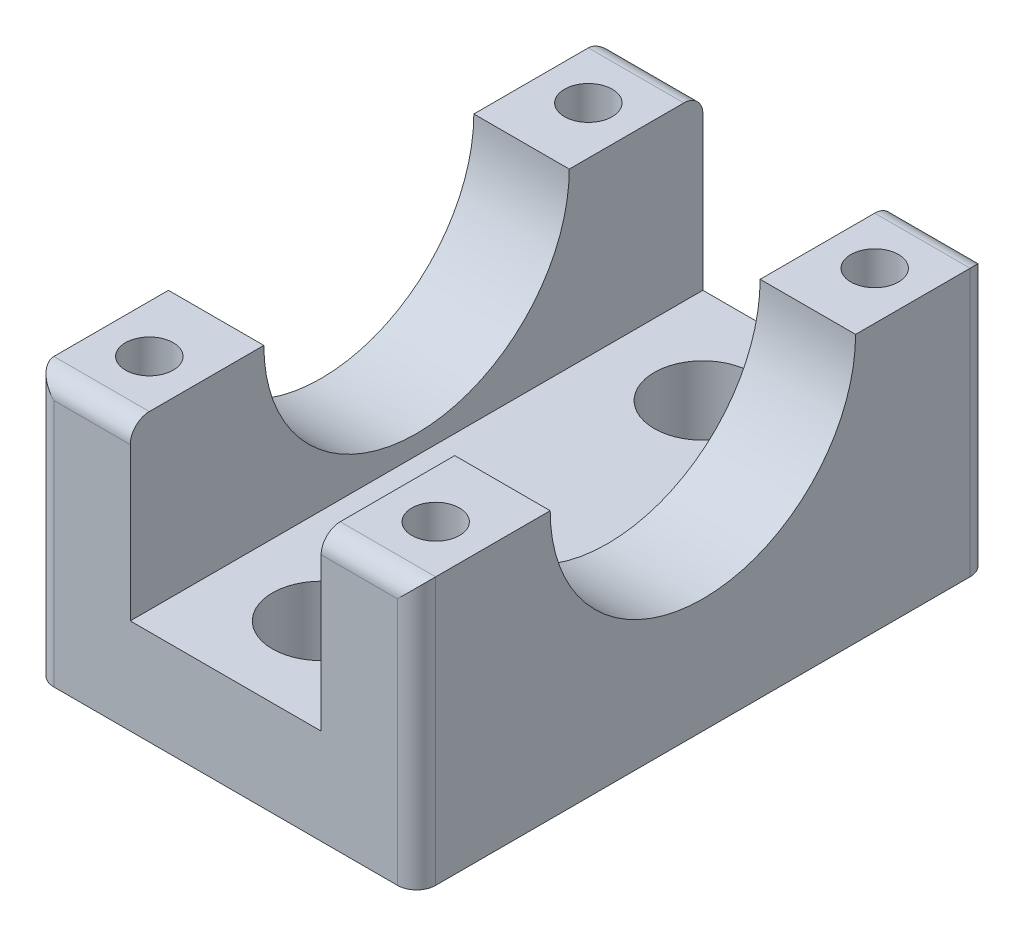
from build123d import *

# Parameters (mm, degrees)
SKETCH1_W           = 20
SKETCH1_H           = 30
BOSS_EXTRUDE1_DEPTH = 5
SKETCH2_R           = 2.55
CUT_EXTRUDE1_DEPTH  = 19.708286934
SKETCH3_W           = 5
SKETCH3_H           = 30
BOSS_EXTRUDE2_DEPTH = 9
SKETCH4_R           = 8
CUT_EXTRUDE2_DEPTH  = 29.653097564
SKETCH5_R           = 1.25
CUT_EXTRUDE3_DEPTH  = 10
FILLET1_R           = 1


with BuildPart() as part:
    # Sketch1 → Boss-Extrude1 (new body)
    with BuildSketch(Plane(origin=(0, 0, 0), x_dir=(1, 0, 0), z_dir=(0, 1, 0))):
        Rectangle(SKETCH1_W, SKETCH1_H)
    extrude(amount=BOSS_EXTRUDE1_DEPTH)

    # Sketch2 → Cut-Extrude1 (cut, through all)
    with BuildSketch(Plane(origin=(0, 5, 0), x_dir=(1, 0, 0), z_dir=(0, 1, 0))):
        with Locations(Location((0, 10, 0), (0, 0, 270))):
            Circle(SKETCH2_R)
        with Locations(Location((0, -10, 0), (0, 0, 270))):
            Circle(SKETCH2_R)
    extrude(amount=-CUT_EXTRUDE1_DEPTH, mode=Mode.SUBTRACT)

    # Sketch3 → Boss-Extrude2 (add)
    with BuildSketch(Plane(origin=(0, 5, 0), x_dir=(1, 0, 0), z_dir=(0, 1, 0))):
        with Locations((-7.5, 0)):
            Rectangle(SKETCH3_W, SKETCH3_H)
    boss_extrude2 = extrude(amount=BOSS_EXTRUDE2_DEPTH)

    # Sketch4 → Cut-Extrude2 (cut, through all)
    with BuildSketch(Plane.ZY.offset(10)):
        with Locations((0, 14)):
            Circle(SKETCH4_R)
    cut_extrude2 = extrude(amount=-CUT_EXTRUDE2_DEPTH, mode=Mode.SUBTRACT)

    # Sketch5 → Cut-Extrude3 (cut)
    with BuildSketch(Plane(origin=(0, 14, 0), x_dir=(1, 0, 0), z_dir=(0, 1, 0))):
        with Locations(Location((-7.5, 11.5, 0), (0, 0, 270))):
            Circle(SKETCH5_R)
        with Locations(Location((-7.5, -11.5, 0), (0, 0, 270))):
            Circle(SKETCH5_R)
    cut_extrude3 = extrude(amount=-CUT_EXTRUDE3_DEPTH, mode=Mode.SUBTRACT)

    # Mirror1: Boss-Extrude2, Cut-Extrude2, Cut-Extrude3 across plane
    add(boss_extrude2.mirror(Plane(origin=(0, 0, 0), x_dir=(0, 0, 1), z_dir=(1, 0, 0))))
    add(cut_extrude2.mirror(Plane(origin=(0, 0, 0), x_dir=(0, 0, 1), z_dir=(1, 0, 0))), mode=Mode.SUBTRACT)
    add(cut_extrude3.mirror(Plane(origin=(0, 0, 0), x_dir=(0, 0, 1), z_dir=(1, 0, 0))), mode=Mode.SUBTRACT)

    # Fillet1
    fillet1_edges = [part.edges().sort_by_distance(p)[0] for p in [
        (-10, 7, -15),
        (10, 7, -15),
        (10, 7, 15),
        (-10, 7, 15),
        (-7.5, 14, -15),
        (7.5, 14, -15),
        (7.5, 14, 15),
        (-7.5, 14, 15),
    ]]
    fillet(fillet1_edges, radius=FILLET1_R)


solid = part.part
